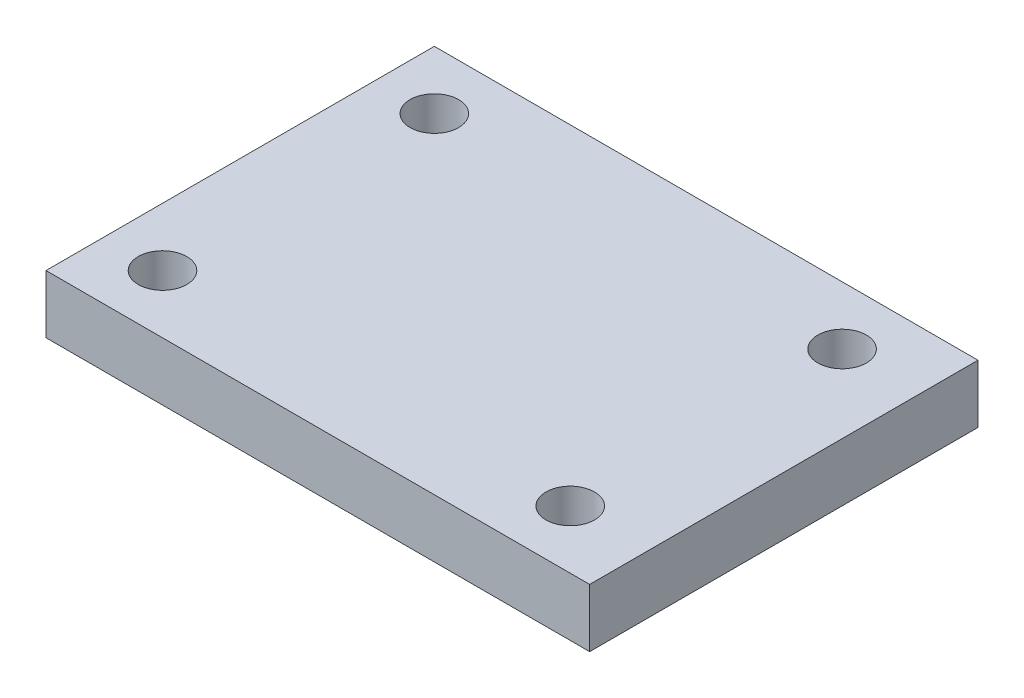
from build123d import *

# Parameters (mm, degrees)
SKETCH1_W           = 28
SKETCH1_H           = 20
BOSS_EXTRUDE1_DEPTH = 3
M3_TAPPED_HOLE1_D   = 2.5


with BuildPart() as part:
    # Sketch1 → Boss-Extrude1 (new body)
    with BuildSketch(Plane(origin=(0, 0, 0), x_dir=(1, 0, 0), z_dir=(0, 1, 0))):
        Rectangle(SKETCH1_W, SKETCH1_H)
    extrude(amount=BOSS_EXTRUDE1_DEPTH)

    # M3 Tapped Hole1 (through all)
    with Locations(Plane(origin=(0, 3, 0), x_dir=(1, 0, 0), z_dir=(0, 1, 0))):
        with Locations((-11, 7), (-11, -7), (10, -7), (10, 7)):
            Hole(M3_TAPPED_HOLE1_D / 2)


solid = part.part
